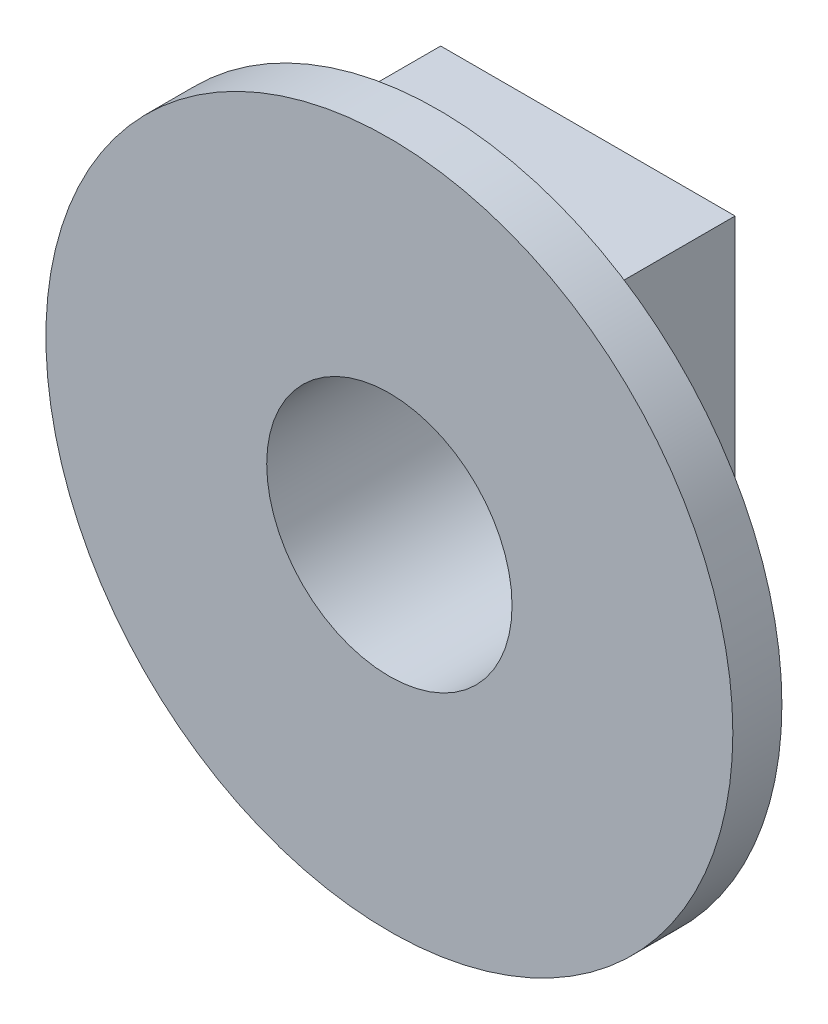
from build123d import *

# Parameters (mm, degrees)
SKETCH1_R           = 7
BOSS_EXTRUDE1_DEPTH = 1
SKETCH3_W           = 3
SKETCH3_H           = 10
BOSS_EXTRUDE2_DEPTH = 3
SKETCH5_R           = 2.5
CUT_EXTRUDE1_DEPTH  = 5


with BuildPart() as part:
    # Sketch1 → Boss-Extrude1 (new body)
    with BuildSketch(Plane.XY):
        with Locations((-7.345808821, 32.102080843)):
            Circle(SKETCH1_R)
    extrude(amount=BOSS_EXTRUDE1_DEPTH)

    # Sketch3 → Boss-Extrude2 (add, symmetric)
    with BuildSketch(Plane(origin=(-7.3, 0, 0), x_dir=(0, 0, -1), z_dir=(1, 0, 0))):
        with Locations((1.5, 32.250632967)):
            Rectangle(SKETCH3_W, SKETCH3_H)
    extrude(amount=BOSS_EXTRUDE2_DEPTH, both=True)

    # Sketch5 → Cut-Extrude1 (cut)
    with BuildSketch(Plane.XY.offset(1)):
        with Locations((-7.345808821, 32.102080843)):
            Circle(SKETCH5_R)
    extrude(amount=-CUT_EXTRUDE1_DEPTH, mode=Mode.SUBTRACT)


solid = part.part
